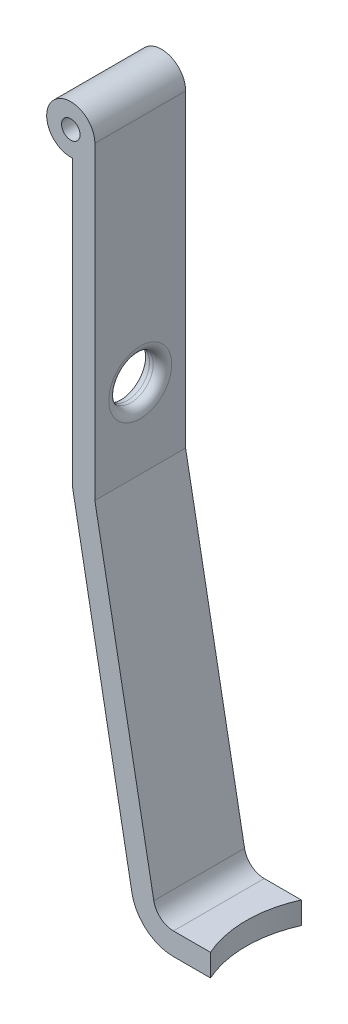
from build123d import *

# Parameters (mm, degrees)
SKETCH1_R           = 1.25
BOSS_EXTRUDE1_DEPTH = 12.25
CUT_EXTRUDE1_REACH  = 94.464
SKETCH2_R           = 3
FILLET1_R           = 1.25
CUT_EXTRUDE2_REACH  = 94.757


with BuildPart() as part:
    # Sketch1 → Boss-Extrude1 (new body)
    with BuildSketch(Plane.XY):
        with BuildLine():
            Line((0.25, -3.240370349), (0.25, -41.740370349))
            Line((0.25, -41.740370349), (8.25, -85.075157412))
            ThreePointArc((8.25, -85.075157412), (10.208936196, -88.421482437), (13.855284626, -89.740370349))
            Line((13.855284626, -89.740370349), (18.855284626, -89.740370349))
            Line((18.855284626, -89.740370349), (18.855284626, -86.740370349))
            Line((18.855284626, -86.740370349), (13.855284626, -86.740370349))
            ThreePointArc((13.855284626, -86.740370349), (12.129255683, -86.116622764), (11.200712952, -84.533573379))
            Line((11.200712952, -84.533573379), (3.25, -41.740370349))
            Line((3.25, -41.740370349), (3.25, 0))
            ThreePointArc((3.25, 0), (-2.384848004, 2.207940217), (0.25, -3.240370349))
        make_face()
        Circle(SKETCH1_R, mode=Mode.SUBTRACT)
    extrude(amount=BOSS_EXTRUDE1_DEPTH)

    # Sketch2 → Cut-Extrude1 (cut, up to next)
    with BuildSketch(Plane.ZY.offset(-0.25), mode=Mode.PRIVATE) as cut_extrude1_sk1:
        with Locations(Location((6.125, -31, 0), (0, 0, 270))):
            Circle(SKETCH2_R)
    cut_extrude1_tool1 = extrude(cut_extrude1_sk1.sketch, amount=-CUT_EXTRUDE1_REACH, mode=Mode.PRIVATE) & part.part
    add(cut_extrude1_tool1.solids().sort_by_distance((0.25, -31, 6.125))[0], mode=Mode.SUBTRACT)

    # Fillet1
    fillet1_edges = [part.edges().sort_by_distance(p)[0] for p in [
        (0.25, -28, 6.125),
        (3.25, -28, 6.125),
    ]]
    fillet(fillet1_edges, radius=FILLET1_R)

    # Sketch4 → Cut-Extrude2 (cut, up to next)
    with BuildSketch(Plane(origin=(0, -86.740370349, 0), x_dir=(1, 0, 0), z_dir=(0, 1, 0)), mode=Mode.PRIVATE) as cut_extrude2_sk1:
        with BuildLine():
            Line((18.855284626, 0), (18.855284626, -12.25))
            ThreePointArc((18.855284626, -12.25), (17.547778007, -6.125), (18.855284626, 0))
        make_face()
    cut_extrude2_tool1 = extrude(cut_extrude2_sk1.sketch, amount=-CUT_EXTRUDE2_REACH, mode=Mode.PRIVATE) & part.part
    add(cut_extrude2_tool1.solids().sort_by_distance((18.330278, -86.74037, 6.125))[0], mode=Mode.SUBTRACT)


solid = part.part
